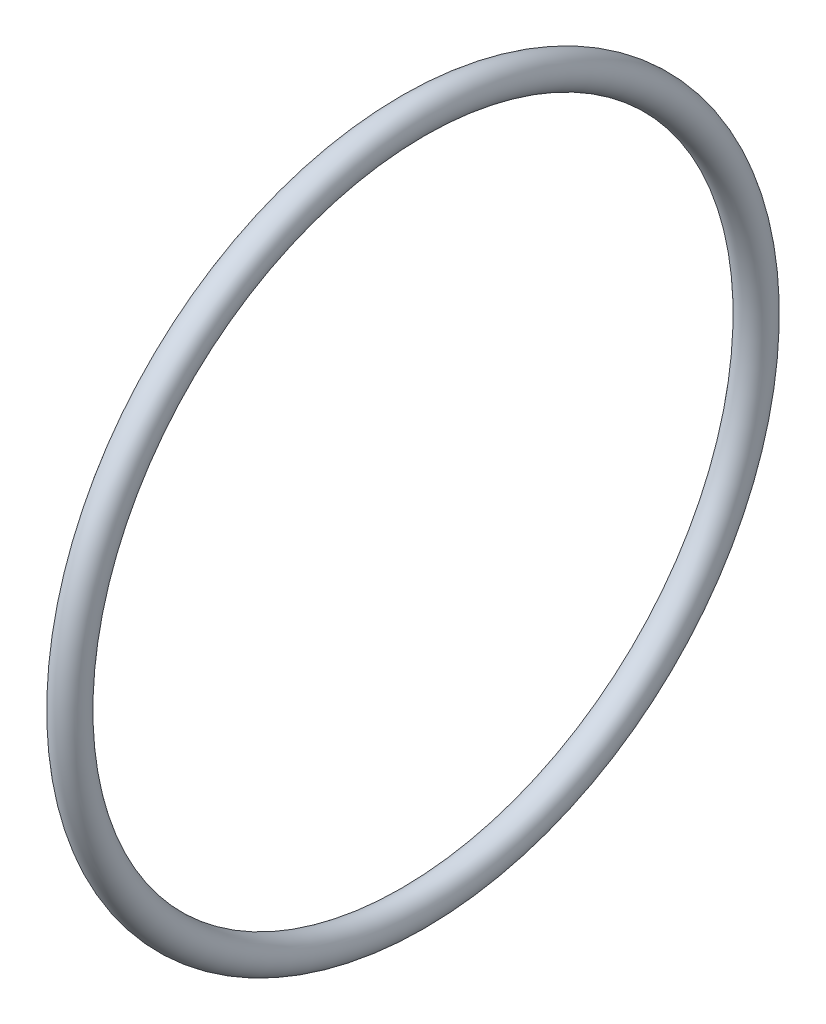
from build123d import *

# Parameters (mm, degrees)
SKETCH2_R = 1


with BuildPart() as part:
    # Sweep1: sweep along a path in Sketch1
    with BuildLine(Plane(origin=(0, 0, 0), x_dir=(0, 0, -1), z_dir=(1, 0, 0))) as sweep1_path:
        CenterArc((0, 0), 21, 0, 360)
    # Sketch2 → Sweep1 (sweep)
    with BuildSketch(Plane.XY):
        with Locations((0, 21)):
            Circle(SKETCH2_R)
    sweep(path=sweep1_path.line)


solid = part.part
